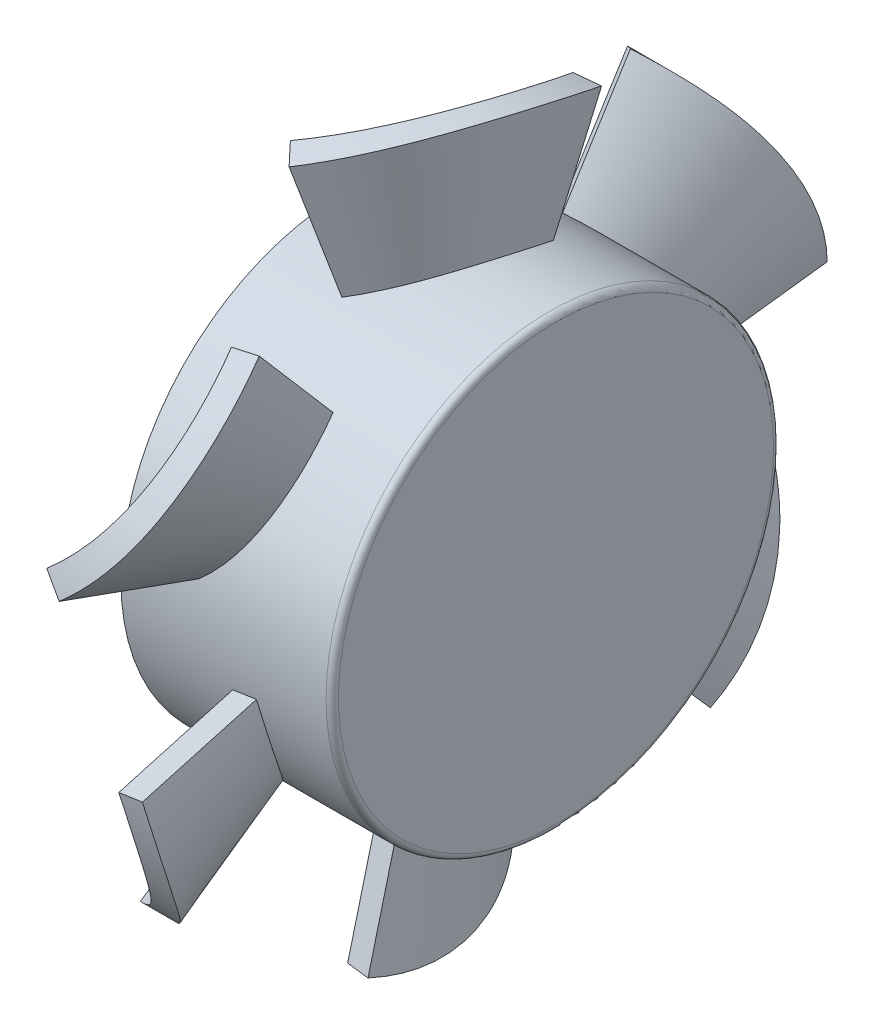
from build123d import *

# Parameters (mm, degrees)
REVOLVE3_ANGLE           = 35
REVOLVE3_OTHER_WAY_ANGLE = 35
CIRPATTERN1_COUNT        = 6
SKETCH8_OUTSIDE_W        = 42.448
SKETCH8_OUTSIDE_H        = 43.096
SKETCH8_OUTSIDE_R        = 14
CUT_EXTRUDE1_DEPTH       = 24.946705857


with BuildPart() as part:
    # Sketch1 → Revolve1 (revolve)
    with BuildSketch(Plane.XY, mode=Mode.PRIVATE) as revolve1_sk:
        with BuildLine():
            Line((-10, 9), (-1.75, 9))
            ThreePointArc((-1.75, 9), (-1.573223305, 8.926776695), (-1.5, 8.75))
            Line((-1.5, 8.75), (-1.5, 0))
            Line((-1.5, 0), (-3, 0))
            Line((-3, 0), (-3, 7.75))
            Line((-3, 7.75), (-10, 7.75))
            Line((-10, 7.75), (-10, 9))
        make_face()
    revolve(revolve1_sk.sketch.rotate(Axis((0, 0, 0), (-1, 0, 0)), 90), axis=Axis((0, 0, 0), (-1, 0, 0)))


with BuildPart() as body_2:
    # Sketch6 → Revolve3 (revolve)
    with BuildSketch(Plane(origin=(-0.750692152, 0.026214748, 2.031649583), x_dir=(-0.9380241231891524, -0.004471483741222242, -0.3465411233149307), z_dir=(0.34656997030213393, -0.01210249004568391, -0.9379460461132464))):
        Polygon((5.267365496, 15.988922273), (4.268057854, 15.951716943), (4.565700491, 7.957255807), (5.565008133, 7.994461136), align=None)
    revolve(axis=Axis((-9.5, 5.745, -1.275), (0.4834449794238033, -0.8545819713199232, 0.18965918423549216)), revolution_arc=REVOLVE3_ANGLE)

    # Sketch6 → Revolve3 other way (revolve)
    with BuildSketch(Plane(origin=(-0.750692152, 0.026214748, 2.031649583), x_dir=(-0.9380241231891524, -0.004471483741222242, -0.3465411233149307), z_dir=(0.34656997030213393, -0.01210249004568391, -0.9379460461132464))):
        Polygon((5.267365496, 15.988922273), (4.268057854, 15.951716943), (4.565700491, 7.957255807), (5.565008133, 7.994461136), align=None)
    revolve(axis=Axis((-9.5, 5.745, -1.275), (-0.4834449794238033, 0.8545819713199232, -0.18965918423549216)), revolution_arc=REVOLVE3_OTHER_WAY_ANGLE)


with BuildPart() as cirpattern1_1:
    # CirPattern1: pattern copy
    add(body_2.part.rotate(Axis((0, 0, 0), (1, 0, 0)), 1 * 360 / CIRPATTERN1_COUNT))


with BuildPart() as cirpattern1_2:
    # CirPattern1: pattern copy
    add(body_2.part.rotate(Axis((0, 0, 0), (1, 0, 0)), 2 * 360 / CIRPATTERN1_COUNT))


with BuildPart() as cirpattern1_3:
    # CirPattern1: pattern copy
    add(body_2.part.rotate(Axis((0, 0, 0), (1, 0, 0)), 3 * 360 / CIRPATTERN1_COUNT))


with BuildPart() as cirpattern1_4:
    # CirPattern1: pattern copy
    add(body_2.part.rotate(Axis((0, 0, 0), (1, 0, 0)), 4 * 360 / CIRPATTERN1_COUNT))


with BuildPart() as cirpattern1_5:
    # CirPattern1: pattern copy
    add(body_2.part.rotate(Axis((0, 0, 0), (1, 0, 0)), 5 * 360 / CIRPATTERN1_COUNT))


with BuildPart() as cirpattern1_3_1:
    add(cirpattern1_3.part)

    # Combine1: union CirPattern1_5, CirPattern1_2, part, CirPattern1_4, body 2, CirPattern1_1
    add(cirpattern1_5.part)
    add(cirpattern1_2.part)
    add(part.part)
    add(cirpattern1_4.part)
    add(body_2.part)
    add(cirpattern1_1.part)

    # Sketch8 outside → Cut-Extrude1 (cut, through all)
    with BuildSketch(Plane(origin=(-1.5, 0, 0), x_dir=(0, 0, -1), z_dir=(1, 0, 0))):
        Rectangle(SKETCH8_OUTSIDE_W, SKETCH8_OUTSIDE_H)
        Circle(SKETCH8_OUTSIDE_R, mode=Mode.SUBTRACT)
    extrude(amount=-CUT_EXTRUDE1_DEPTH, mode=Mode.SUBTRACT)


solid = cirpattern1_3_1.part
